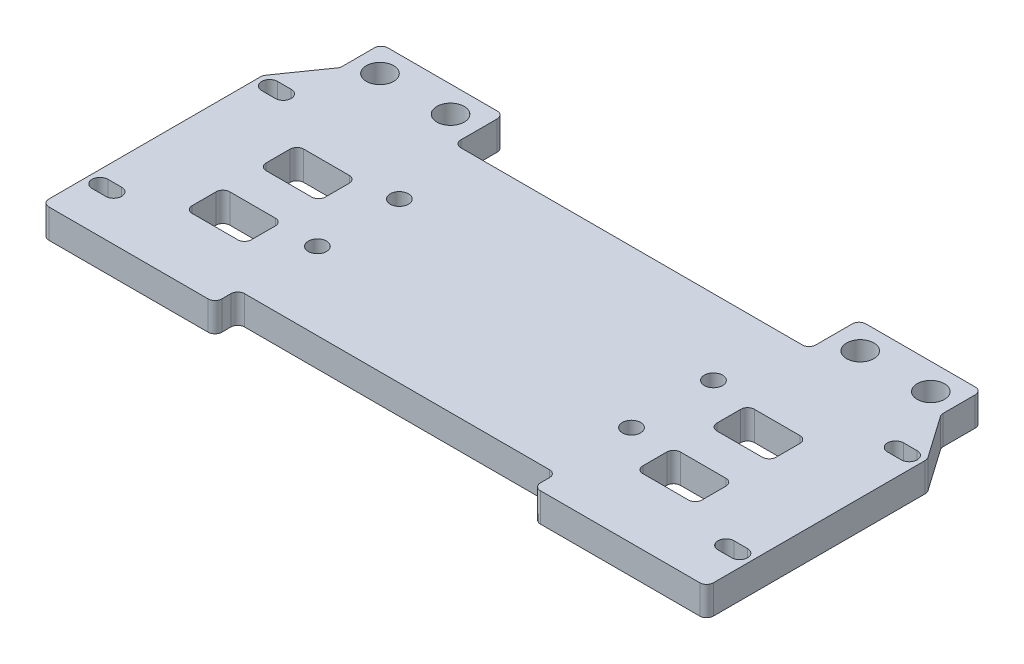
from build123d import *

# Parameters (mm, degrees)
SKETCH1_R           = 2
SKETCH1_R_2         = 3
SKETCH1_W           = 13
SKETCH1_H           = 8.25
BOSS_EXTRUDE1_DEPTH = 6.35
FILLET1_R           = 1.5
SKETCH2_W           = 82.327825706
SKETCH2_H           = 14.458254131
CUT_EXTRUDE1_DEPTH  = 51
SKETCH3_W           = 51.5
SKETCH3_H           = 6.35
BOSS_EXTRUDE2_DEPTH = 25


with BuildPart() as part:
    # Sketch1 → Boss-Extrude1 (new body)
    with BuildSketch(Plane(origin=(0, 0, 0), x_dir=(1, 0, 0), z_dir=(0, 1, 0))):
        Polygon((38, 0), (38, 5), (58, 5), (58, 0), (96, 0), (96, 48.5), (89, 58.5), (89, 67.5), (62, 67.5), (62, 56.5), (34, 56.5), (34, 67.5), (7, 67.5), (7, 58.5), (0, 48.5), (0, 0), align=None)
        with Locations(Location((38.5, 40, 0), (0, 0, 270))):
            Circle(SKETCH1_R, mode=Mode.SUBTRACT)
        with Locations(Location((38.5, 22, 0), (0, 0, 270))):
            Circle(SKETCH1_R, mode=Mode.SUBTRACT)
        with Locations(Location((57.5, 22, 0), (0, 0, 90))):
            Circle(SKETCH1_R, mode=Mode.SUBTRACT)
        with Locations(Location((57.5, 40, 0), (0, 0, 90))):
            Circle(SKETCH1_R, mode=Mode.SUBTRACT)
        with Locations(Location((12.5, 61.75, 0), (0, 0, 270))):
            Circle(SKETCH1_R_2, mode=Mode.SUBTRACT)
        with Locations(Location((28, 61.75, 0), (0, 0, 270))):
            Circle(SKETCH1_R_2, mode=Mode.SUBTRACT)
        with Locations(Location((68, 61.75, 0), (0, 0, 90))):
            Circle(SKETCH1_R_2, mode=Mode.SUBTRACT)
        with Locations(Location((83.5, 61.75, 0), (0, 0, 90))):
            Circle(SKETCH1_R_2, mode=Mode.SUBTRACT)
        with Locations((72.5, 18.625)):
            Rectangle(SKETCH1_W, SKETCH1_H, mode=Mode.SUBTRACT)
        with Locations((23.5, 34.875)):
            Rectangle(SKETCH1_W, SKETCH1_H, mode=Mode.SUBTRACT)
        with Locations((23.5, 18.625)):
            Rectangle(SKETCH1_W, SKETCH1_H, mode=Mode.SUBTRACT)
        with Locations((72.5, 34.875)):
            Rectangle(SKETCH1_W, SKETCH1_H, mode=Mode.SUBTRACT)
        with BuildLine():
            Line((2.75, 11.75), (5.75, 11.75))
            ThreePointArc((5.75, 11.75), (7.5, 10), (5.75, 8.25))
            Line((5.75, 8.25), (2.75, 8.25))
            ThreePointArc((2.75, 8.25), (1, 10), (2.75, 11.75))
        make_face(mode=Mode.SUBTRACT)
        with BuildLine():
            Line((93.25, 8.25), (90.25, 8.25))
            ThreePointArc((90.25, 8.25), (88.5, 10), (90.25, 11.75))
            Line((90.25, 11.75), (93.25, 11.75))
            ThreePointArc((93.25, 11.75), (95, 10), (93.25, 8.25))
        make_face(mode=Mode.SUBTRACT)
        with BuildLine():
            Line((93.25, 45.5), (90.25, 45.5))
            ThreePointArc((90.25, 45.5), (88.5, 47.25), (90.25, 49))
            Line((90.25, 49), (93.25, 49))
            ThreePointArc((93.25, 49), (95, 47.25), (93.25, 45.5))
        make_face(mode=Mode.SUBTRACT)
        with BuildLine():
            Line((2.75, 49), (5.75, 49))
            ThreePointArc((5.75, 49), (7.5, 47.25), (5.75, 45.5))
            Line((5.75, 45.5), (2.75, 45.5))
            ThreePointArc((2.75, 45.5), (1, 47.25), (2.75, 49))
        make_face(mode=Mode.SUBTRACT)
    extrude(amount=BOSS_EXTRUDE1_DEPTH)

    # Fillet1
    fillet1_edges = [part.edges().sort_by_distance(p)[0] for p in [
        (0, 3.175, -48.5),
        (7, 3.175, -58.5),
        (7, 3.175, -67.5),
        (34, 3.175, -67.5),
        (34, 3.175, -56.5),
        (62, 3.175, -56.5),
        (62, 3.175, -67.5),
        (89, 3.175, -67.5),
        (89, 3.175, -58.5),
        (96, 3.175, -48.5),
        (96, 3.175, 0),
        (58, 3.175, 0),
        (58, 3.175, -5),
        (38, 3.175, -5),
        (38, 3.175, 0),
        (0, 3.175, 0),
        (17, 3.175, -39),
        (17, 3.175, -30.75),
        (30, 3.175, -30.75),
        (30, 3.175, -39),
        (17, 3.175, -22.75),
        (17, 3.175, -14.5),
        (30, 3.175, -14.5),
        (30, 3.175, -22.75),
        (79, 3.175, -14.5),
        (79, 3.175, -22.75),
        (66, 3.175, -22.75),
        (66, 3.175, -14.5),
        (79, 3.175, -30.75),
        (79, 3.175, -39),
        (66, 3.175, -39),
        (66, 3.175, -30.75),
    ]]
    fillet(fillet1_edges, radius=FILLET1_R)

    # Sketch2 → Cut-Extrude1 (cut)
    with BuildSketch(Plane(origin=(48, 0, 0), x_dir=(0, 0, -1), z_dir=(1, 0, 0))):
        with Locations((33.293792952, 1.315835649)):
            Rectangle(SKETCH2_W, SKETCH2_H)
    extrude(amount=CUT_EXTRUDE1_DEPTH, mode=Mode.SUBTRACT)

    # Sketch3 → Boss-Extrude2 (add)
    with BuildSketch(Plane(origin=(48, 0, 0), x_dir=(0, 0, -1), z_dir=(1, 0, 0))):
        with Locations((30.75, 3.175)):
            Rectangle(SKETCH3_W, SKETCH3_H)
    extrude(amount=BOSS_EXTRUDE2_DEPTH)

    # Mirror1: part across plane


with BuildPart() as part_1:
    add(part.part)
    add(part.part.mirror(Plane(origin=(73, 0, 0), x_dir=(0, 0, 1), z_dir=(1, 0, 0))))


solid = part_1.part
